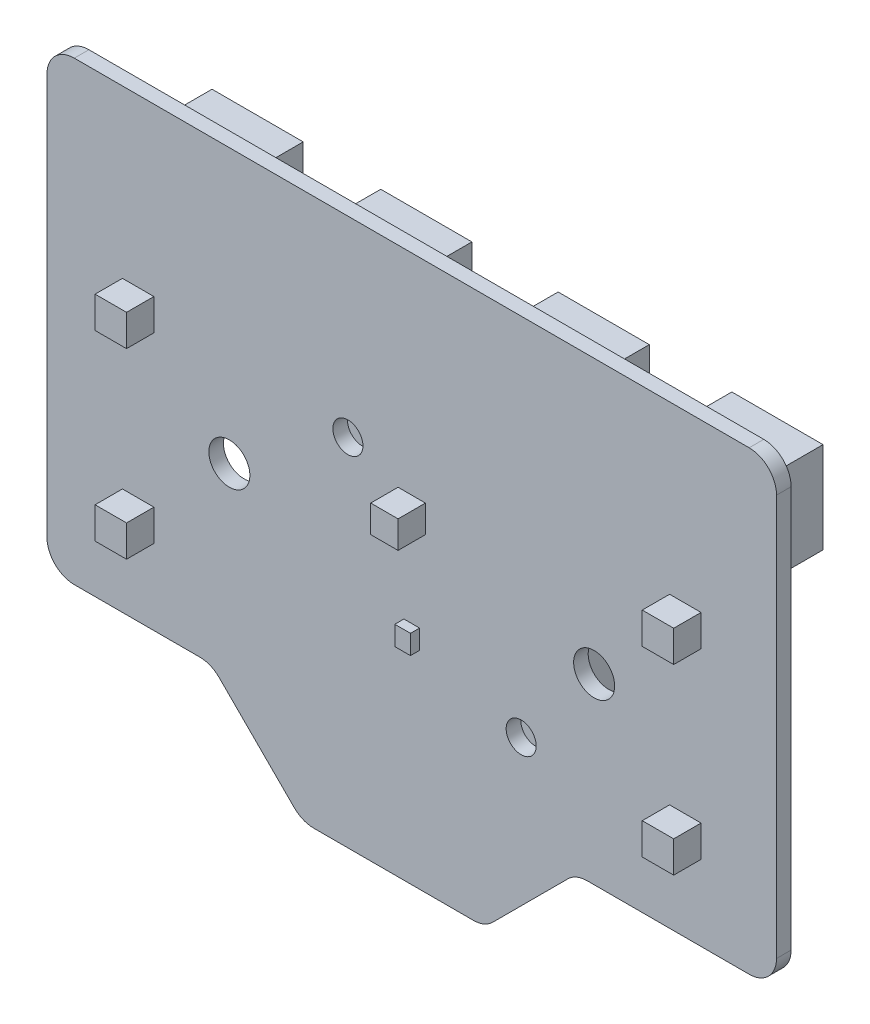
from build123d import *

# Parameters (mm, degrees)
BOSS_EXTRU_1_DEPTH           = 1.6
ESQUISSE3_W                  = 3.45
ESQUISSE3_H                  = 3.45
BOSS_EXTRU_2_DEPTH           = 3
ESQUISSE4_W                  = 3.45
ESQUISSE4_H                  = 3.45
BOSS_EXTRU_3_DEPTH           = 3
ESQUISSE5_W                  = 3
ESQUISSE5_H                  = 3
BOSS_EXTRU_4_DEPTH           = 3
ESQUISSE6_W                  = 1.72
ESQUISSE6_H                  = 2.12
BOSS_EXTRU_5_DEPTH           = 1
ENL_V_MAT_EXTRU_1_DEPTH      = 95.387499172
ENL_V_MAT_EXTRU_1_DEPTH_BACK = 95.387499172
ESQUISSE7_R                  = 2.25
ESQUISSE7_R_2                = 1.65
ESQUISSE8_W                  = 25
ESQUISSE8_H                  = 25
BOSS_EXTRU_6_DEPTH           = 11.5
ESQUISSE9_W                  = 10
ESQUISSE9_H                  = 10
BOSS_EXTRU_7_DEPTH           = 5
ESQUISSE10_W                 = 9.65005
ESQUISSE10_H                 = 4.37005
ESQUISSE10_W_2               = 9.65
BOSS_EXTRU_8_DEPTH           = 5


with BuildPart() as part:
    # Esquisse2 → Boss.-Extru.1 (new body)
    with BuildSketch(Plane.XY):
        with BuildLine():
            Line((0, 3), (0, 47))
            ThreePointArc((0, 47), (0.878679656, 49.121320344), (3, 50))
            Line((3, 50), (77, 50))
            ThreePointArc((77, 50), (79.121320344, 49.121320344), (80, 47))
            Line((80, 47), (80, 3))
            ThreePointArc((80, 3), (79.121320344, 0.878679656), (77, 0))
            Line((77, 0), (59.2426, 0))
            ThreePointArc((59.2426, 0), (58.094558305, -0.228374693), (57.1213, -0.8787))
            Line((57.1213, -0.8787), (48.8787, -9.1213))
            ThreePointArc((48.8787, -9.1213), (47.905441695, -9.771625307), (46.7574, -10))
            Line((46.7574, -10), (29.2426, -10))
            ThreePointArc((29.2426, -10), (28.094558305, -9.771625307), (27.1213, -9.1213))
            Line((27.1213, -9.1213), (18.8787, -0.8787))
            ThreePointArc((18.8787, -0.8787), (17.905441695, -0.228374693), (16.7574, 0))
            Line((16.7574, 0), (3, 0))
            ThreePointArc((3, 0), (0.878679656, 0.878679656), (0, 3))
        make_face()
    extrude(amount=-BOSS_EXTRU_1_DEPTH)

    # Esquisse3 → Boss.-Extru.2 (add)
    with BuildSketch(Plane.XY):
        with Locations((10, 10)):
            Rectangle(ESQUISSE3_W, ESQUISSE3_H)
        with Locations((10, 30)):
            Rectangle(ESQUISSE3_W, ESQUISSE3_H)
    extrude(amount=BOSS_EXTRU_2_DEPTH)

    # Esquisse4 → Boss.-Extru.3 (add)
    with BuildSketch(Plane.XY):
        with Locations((70, 10)):
            Rectangle(ESQUISSE4_W, ESQUISSE4_H)
        with Locations((70, 30)):
            Rectangle(ESQUISSE4_W, ESQUISSE4_H)
    extrude(amount=BOSS_EXTRU_3_DEPTH)

    # Esquisse5 → Boss.-Extru.4 (add)
    with BuildSketch(Plane.XY):
        with Locations((40, 25.5)):
            Rectangle(ESQUISSE5_W, ESQUISSE5_H)
    extrude(amount=BOSS_EXTRU_4_DEPTH)

    # Esquisse6 → Boss.-Extru.5 (add)
    with BuildSketch(Plane.XY):
        with Locations((40, 13.75)):
            Rectangle(ESQUISSE6_W, ESQUISSE6_H)
    extrude(amount=BOSS_EXTRU_5_DEPTH)

    # Esquisse7 → Enlèv. mat.-Extru.1 (cut, two sides: drawn at the far end of the back side and taken through both)
    with BuildSketch(Plane.XY.offset(-ENL_V_MAT_EXTRU_1_DEPTH_BACK)):
        with Locations((20, 20)):
            Circle(ESQUISSE7_R)
        with Locations((60, 20)):
            Circle(ESQUISSE7_R)
        with Locations((33, 29)):
            Circle(ESQUISSE7_R_2)
        with Locations((52, 10)):
            Circle(ESQUISSE7_R_2)
    extrude(amount=ENL_V_MAT_EXTRU_1_DEPTH + ENL_V_MAT_EXTRU_1_DEPTH_BACK, mode=Mode.SUBTRACT)

    # Esquisse8 → Boss.-Extru.6 (add)
    with BuildSketch(Plane(origin=(0, 0, -1.6), x_dir=(-1, 0, 0), z_dir=(0, 0, -1))):
        with Locations((-42.5, 19.5)):
            Rectangle(ESQUISSE8_W, ESQUISSE8_H)
    extrude(amount=BOSS_EXTRU_6_DEPTH)

    # Esquisse9 → Boss.-Extru.7 (add)
    with BuildSketch(Plane(origin=(0, 0, -1.6), x_dir=(-1, 0, 0), z_dir=(0, 0, -1))):
        with Locations((-16.5, 43)):
            Rectangle(ESQUISSE9_W, ESQUISSE9_H)
        with Locations((-35, 42.75)):
            Rectangle(ESQUISSE9_W, ESQUISSE9_H)
        with Locations((-54.45, 42.72)):
            Rectangle(ESQUISSE9_W, ESQUISSE9_H)
        with Locations((-73.5, 42.75)):
            Rectangle(ESQUISSE9_W, ESQUISSE9_H)
    extrude(amount=BOSS_EXTRU_7_DEPTH)

    # Esquisse10 → Boss.-Extru.8 (add)
    with BuildSketch(Plane(origin=(0, 0, -1.6), x_dir=(-1, 0, 0), z_dir=(0, 0, -1))):
        with Locations((-31.500025, -3.715025)):
            Rectangle(ESQUISSE10_W, ESQUISSE10_H)
        with Locations((-44.75, -3.715025)):
            Rectangle(ESQUISSE10_W_2, ESQUISSE10_H)
    extrude(amount=BOSS_EXTRU_8_DEPTH)


solid = part.part
